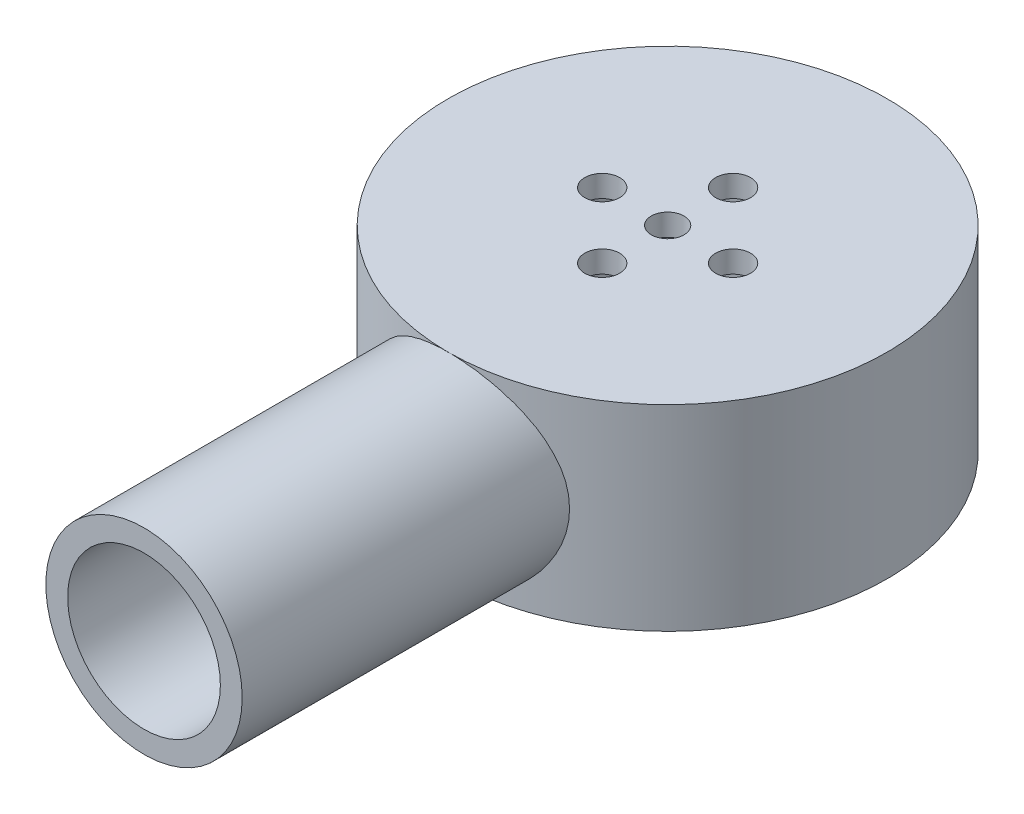
from build123d import *

# Parameters (mm, degrees)
SKETCH1_R           = 9
SKETCH1_R_2         = 7
BOSS_EXTRUDE1_DEPTH = 30
BOSS_EXTRUDE2_START = 9
SKETCH3_R           = 20.124611797
SKETCH3_R_2         = 1.5
SKETCH3_R_3         = 1.6
BOSS_EXTRUDE2_DEPTH = 18
SKETCH4_R           = 18.124611797
CUT_EXTRUDE1_DEPTH  = 16


with BuildPart() as part:
    # Sketch1 → Boss-Extrude1 (new body)
    with BuildSketch(Plane.XY):
        Circle(SKETCH1_R)
        Circle(SKETCH1_R_2, mode=Mode.SUBTRACT)
    extrude(amount=-BOSS_EXTRUDE1_DEPTH)


with BuildPart() as body_2:
    # Sketch3 → Boss-Extrude2 (new body)
    with BuildSketch(Plane(origin=(0, 0, 0), x_dir=(1, 0, 0), z_dir=(0, 1, 0)).offset(BOSS_EXTRUDE2_START)):
        with Locations(Location((0, 48, 0), (0, 0, 270))):
            Circle(SKETCH3_R)
        with Locations(Location((0, 48, 0), (0, 0, 270))):
            Circle(SKETCH3_R_2, mode=Mode.SUBTRACT)
        with Locations(Location((0, 42, 0), (0, 0, 270))):
            Circle(SKETCH3_R_3, mode=Mode.SUBTRACT)
        with Locations(Location((-6, 48, 0), (0, 0, 270))):
            Circle(SKETCH3_R_3, mode=Mode.SUBTRACT)
        with Locations(Location((6, 48, 0), (0, 0, 270))):
            Circle(SKETCH3_R_3, mode=Mode.SUBTRACT)
        with Locations(Location((0, 54, 0), (0, 0, 270))):
            Circle(SKETCH3_R_3, mode=Mode.SUBTRACT)
    extrude(amount=-BOSS_EXTRUDE2_DEPTH)


with BuildPart() as cut_extrude1_tool:
    # Sketch4 → Cut-Extrude1 (new body)
    with BuildSketch(Plane.XZ.offset(9)):
        with Locations(Location((0, -48, 0), (0, 0, 270))):
            Circle(SKETCH4_R)
    extrude(amount=-CUT_EXTRUDE1_DEPTH)


with BuildPart() as part_1:
    add(part.part)

    # Cut-Extrude1: cut by cut_extrude1_tool
    add(cut_extrude1_tool.part, mode=Mode.SUBTRACT)


with BuildPart() as body_2_1:
    add(body_2.part)

    # Cut-Extrude1: cut by cut_extrude1_tool
    add(cut_extrude1_tool.part, mode=Mode.SUBTRACT)


solid = Compound([part_1.part, body_2_1.part])
